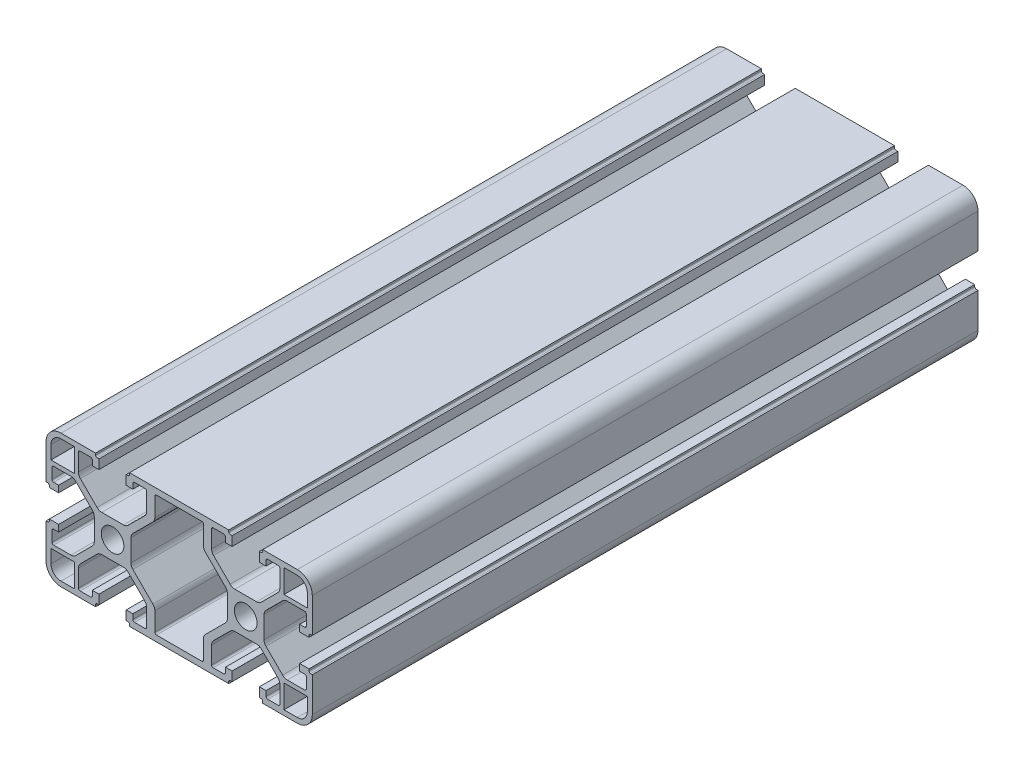
from build123d import *

# Parameters (mm, degrees)
SKETCH_1_R      = 3.4
EXTRUDE_1_DEPTH = 200


with BuildPart() as part:
    # 草图1 → 凸台-拉伸1 (new body)
    with BuildSketch(Plane.XY):
        with BuildLine():
            Line((3.257359313, 5.5), (-3.257359313, 5.5))
            ThreePointArc((-3.257359313, 5.5), (-4.022726178, 5.652240935), (-4.671572875, 6.085786438))
            Line((-4.671572875, 6.085786438), (-9.664213562, 11.078427125))
            ThreePointArc((-9.664213562, 11.078427125), (-10.097759065, 11.727273822), (-10.25, 12.492640687))
            Line((-10.25, 12.492640687), (-10.25, 17.7))
            ThreePointArc((-10.25, 17.7), (-10.103553391, 18.053553391), (-9.75, 18.2))
            Line((-9.75, 18.2), (-6.6, 18.2))
            ThreePointArc((-6.6, 18.2), (-6.246446609, 18.053553391), (-6.1, 17.7))
            Line((-6.1, 17.7), (-6.1, 16.2))
            Line((-6.1, 16.2), (-4.1, 16.2))
            Line((-4.1, 16.2), (-4.1, 19))
            Line((-4.1, 19), (-4.6, 19))
            ThreePointArc((-4.6, 19), (-4.953553391, 19.146446609), (-5.1, 19.5))
            Line((-5.1, 19.5), (-5.1, 20))
            Line((-5.1, 20), (-15.5, 20))
            ThreePointArc((-15.5, 20), (-18.681980515, 18.681980515), (-20, 15.5))
            Line((-20, 15.5), (-20, 5.1))
            Line((-20, 5.1), (-19.5, 5.1))
            ThreePointArc((-19.5, 5.1), (-19.146446609, 4.953553391), (-19, 4.6))
            Line((-19, 4.6), (-19, 4.1))
            Line((-19, 4.1), (-16.2, 4.1))
            Line((-16.2, 4.1), (-16.2, 6.1))
            Line((-16.2, 6.1), (-17.7, 6.1))
            ThreePointArc((-17.7, 6.1), (-18.053553391, 6.246446609), (-18.2, 6.6))
            Line((-18.2, 6.6), (-18.2, 9.75))
            ThreePointArc((-18.2, 9.75), (-18.053553391, 10.103553391), (-17.7, 10.25))
            Line((-17.7, 10.25), (-12.492640687, 10.25))
            ThreePointArc((-12.492640687, 10.25), (-11.727273822, 10.097759065), (-11.078427125, 9.664213562))
            Line((-11.078427125, 9.664213562), (-6.085786438, 4.671572875))
            ThreePointArc((-6.085786438, 4.671572875), (-5.652240935, 4.022726178), (-5.5, 3.257359313))
            Line((-5.5, 3.257359313), (-5.5, -3.257359313))
            ThreePointArc((-5.5, -3.257359313), (-5.652240935, -4.022726178), (-6.085786438, -4.671572875))
            Line((-6.085786438, -4.671572875), (-11.078427125, -9.664213562))
            ThreePointArc((-11.078427125, -9.664213562), (-11.727273822, -10.097759065), (-12.492640687, -10.25))
            Line((-12.492640687, -10.25), (-17.7, -10.25))
            ThreePointArc((-17.7, -10.25), (-18.053553391, -10.103553391), (-18.2, -9.75))
            Line((-18.2, -9.75), (-18.2, -6.6))
            ThreePointArc((-18.2, -6.6), (-18.053553391, -6.246446609), (-17.7, -6.1))
            Line((-17.7, -6.1), (-16.2, -6.1))
            Line((-16.2, -6.1), (-16.2, -4.1))
            Line((-16.2, -4.1), (-19, -4.1))
            Line((-19, -4.1), (-19, -4.6))
            ThreePointArc((-19, -4.6), (-19.146446609, -4.953553391), (-19.5, -5.1))
            Line((-19.5, -5.1), (-20, -5.1))
            Line((-20, -5.1), (-20, -15.5))
            ThreePointArc((-20, -15.5), (-18.681980515, -18.681980515), (-15.5, -20))
            Line((-15.5, -20), (-5.1, -20))
            Line((-5.1, -20), (-5.1, -19.5))
            ThreePointArc((-5.1, -19.5), (-4.953553391, -19.146446609), (-4.6, -19))
            Line((-4.6, -19), (-4.1, -19))
            Line((-4.1, -19), (-4.1, -16.2))
            Line((-4.1, -16.2), (-6.1, -16.2))
            Line((-6.1, -16.2), (-6.1, -17.7))
            ThreePointArc((-6.1, -17.7), (-6.246446609, -18.053553391), (-6.6, -18.2))
            Line((-6.6, -18.2), (-9.75, -18.2))
            ThreePointArc((-9.75, -18.2), (-10.103553391, -18.053553391), (-10.25, -17.7))
            Line((-10.25, -17.7), (-10.25, -12.492640687))
            ThreePointArc((-10.25, -12.492640687), (-10.097759065, -11.727273822), (-9.664213562, -11.078427125))
            Line((-9.664213562, -11.078427125), (-4.671572875, -6.085786438))
            ThreePointArc((-4.671572875, -6.085786438), (-4.022726178, -5.652240935), (-3.257359313, -5.5))
            Line((-3.257359313, -5.5), (3.257359313, -5.5))
            ThreePointArc((3.257359313, -5.5), (4.022726178, -5.652240935), (4.671572875, -6.085786438))
            Line((4.671572875, -6.085786438), (9.664213562, -11.078427125))
            ThreePointArc((9.664213562, -11.078427125), (10.097759065, -11.727273822), (10.25, -12.492640687))
            Line((10.25, -12.492640687), (10.25, -17.7))
            ThreePointArc((10.25, -17.7), (10.103553391, -18.053553391), (9.75, -18.2))
            Line((9.75, -18.2), (6.6, -18.2))
            ThreePointArc((6.6, -18.2), (6.246446609, -18.053553391), (6.1, -17.7))
            Line((6.1, -17.7), (6.1, -16.2))
            Line((6.1, -16.2), (4.1, -16.2))
            Line((4.1, -16.2), (4.1, -19))
            Line((4.1, -19), (4.6, -19))
            ThreePointArc((4.6, -19), (4.953553391, -19.146446609), (5.1, -19.5))
            Line((5.1, -19.5), (5.1, -20))
            Line((5.1, -20), (34.9, -20))
            Line((34.9, -20), (34.9, -19.5))
            ThreePointArc((34.9, -19.5), (35.046446609, -19.146446609), (35.4, -19))
            Line((35.4, -19), (35.9, -19))
            Line((35.9, -19), (35.9, -16.2))
            Line((35.9, -16.2), (33.9, -16.2))
            Line((33.9, -16.2), (33.9, -17.7))
            ThreePointArc((33.9, -17.7), (33.753553391, -18.053553391), (33.4, -18.2))
            Line((33.4, -18.2), (30.25, -18.2))
            ThreePointArc((30.25, -18.2), (29.896446609, -18.053553391), (29.75, -17.7))
            Line((29.75, -17.7), (29.75, -12.492640687))
            ThreePointArc((29.75, -12.492640687), (29.902240935, -11.727273822), (30.335786438, -11.078427125))
            Line((30.335786438, -11.078427125), (35.328427125, -6.085786438))
            ThreePointArc((35.328427125, -6.085786438), (35.977273822, -5.652240935), (36.742640687, -5.5))
            Line((36.742640687, -5.5), (43.257359313, -5.5))
            ThreePointArc((43.257359313, -5.5), (44.022726178, -5.652240935), (44.671572875, -6.085786438))
            Line((44.671572875, -6.085786438), (49.664213562, -11.078427125))
            ThreePointArc((49.664213562, -11.078427125), (50.097759065, -11.727273822), (50.25, -12.492640687))
            Line((50.25, -12.492640687), (50.25, -17.7))
            ThreePointArc((50.25, -17.7), (50.103553391, -18.053553391), (49.75, -18.2))
            Line((49.75, -18.2), (46.6, -18.2))
            ThreePointArc((46.6, -18.2), (46.246446609, -18.053553391), (46.1, -17.7))
            Line((46.1, -17.7), (46.1, -16.2))
            Line((46.1, -16.2), (44.1, -16.2))
            Line((44.1, -16.2), (44.1, -19))
            Line((44.1, -19), (44.6, -19))
            ThreePointArc((44.6, -19), (44.953553391, -19.146446609), (45.1, -19.5))
            Line((45.1, -19.5), (45.1, -20))
            Line((45.1, -20), (55.5, -20))
            ThreePointArc((55.5, -20), (58.681980515, -18.681980515), (60, -15.5))
            Line((60, -15.5), (60, -5.1))
            Line((60, -5.1), (59.5, -5.1))
            ThreePointArc((59.5, -5.1), (59.146446609, -4.953553391), (59, -4.6))
            Line((59, -4.6), (59, -4.1))
            Line((59, -4.1), (56.2, -4.1))
            Line((56.2, -4.1), (56.2, -6.1))
            Line((56.2, -6.1), (57.7, -6.1))
            ThreePointArc((57.7, -6.1), (58.053553391, -6.246446609), (58.2, -6.6))
            Line((58.2, -6.6), (58.2, -9.75))
            ThreePointArc((58.2, -9.75), (58.053553391, -10.103553391), (57.7, -10.25))
            Line((57.7, -10.25), (52.492640687, -10.25))
            ThreePointArc((52.492640687, -10.25), (51.727273822, -10.097759065), (51.078427125, -9.664213562))
            Line((51.078427125, -9.664213562), (46.085786438, -4.671572875))
            ThreePointArc((46.085786438, -4.671572875), (45.652240935, -4.022726178), (45.5, -3.257359313))
            Line((45.5, -3.257359313), (45.5, 3.257359313))
            ThreePointArc((45.5, 3.257359313), (45.652240935, 4.022726178), (46.085786438, 4.671572875))
            Line((46.085786438, 4.671572875), (51.078427125, 9.664213562))
            ThreePointArc((51.078427125, 9.664213562), (51.727273822, 10.097759065), (52.492640687, 10.25))
            Line((52.492640687, 10.25), (57.7, 10.25))
            ThreePointArc((57.7, 10.25), (58.053553391, 10.103553391), (58.2, 9.75))
            Line((58.2, 9.75), (58.2, 6.6))
            ThreePointArc((58.2, 6.6), (58.053553391, 6.246446609), (57.7, 6.1))
            Line((57.7, 6.1), (56.2, 6.1))
            Line((56.2, 6.1), (56.2, 4.1))
            Line((56.2, 4.1), (59, 4.1))
            Line((59, 4.1), (59, 4.6))
            ThreePointArc((59, 4.6), (59.146446609, 4.953553391), (59.5, 5.1))
            Line((59.5, 5.1), (60, 5.1))
            Line((60, 5.1), (60, 15.5))
            ThreePointArc((60, 15.5), (58.681980515, 18.681980515), (55.5, 20))
            Line((55.5, 20), (45.1, 20))
            Line((45.1, 20), (45.1, 19.5))
            ThreePointArc((45.1, 19.5), (44.953553391, 19.146446609), (44.6, 19))
            Line((44.6, 19), (44.1, 19))
            Line((44.1, 19), (44.1, 16.2))
            Line((44.1, 16.2), (46.1, 16.2))
            Line((46.1, 16.2), (46.1, 17.7))
            ThreePointArc((46.1, 17.7), (46.246446609, 18.053553391), (46.6, 18.2))
            Line((46.6, 18.2), (49.75, 18.2))
            ThreePointArc((49.75, 18.2), (50.103553391, 18.053553391), (50.25, 17.7))
            Line((50.25, 17.7), (50.25, 12.492640687))
            ThreePointArc((50.25, 12.492640687), (50.097759065, 11.727273822), (49.664213562, 11.078427125))
            Line((49.664213562, 11.078427125), (44.671572875, 6.085786438))
            ThreePointArc((44.671572875, 6.085786438), (44.022726178, 5.652240935), (43.257359313, 5.5))
            Line((43.257359313, 5.5), (36.742640687, 5.5))
            ThreePointArc((36.742640687, 5.5), (35.977273822, 5.652240935), (35.328427125, 6.085786438))
            Line((35.328427125, 6.085786438), (30.335786438, 11.078427125))
            ThreePointArc((30.335786438, 11.078427125), (29.902240935, 11.727273822), (29.75, 12.492640687))
            Line((29.75, 12.492640687), (29.75, 17.7))
            ThreePointArc((29.75, 17.7), (29.896446609, 18.053553391), (30.25, 18.2))
            Line((30.25, 18.2), (33.4, 18.2))
            ThreePointArc((33.4, 18.2), (33.753553391, 18.053553391), (33.9, 17.7))
            Line((33.9, 17.7), (33.9, 16.2))
            Line((33.9, 16.2), (35.9, 16.2))
            Line((35.9, 16.2), (35.9, 19))
            Line((35.9, 19), (35.4, 19))
            ThreePointArc((35.4, 19), (35.046446609, 19.146446609), (34.9, 19.5))
            Line((34.9, 19.5), (34.9, 20))
            Line((34.9, 20), (5.1, 20))
            Line((5.1, 20), (5.1, 19.5))
            ThreePointArc((5.1, 19.5), (4.953553391, 19.146446609), (4.6, 19))
            Line((4.6, 19), (4.1, 19))
            Line((4.1, 19), (4.1, 16.2))
            Line((4.1, 16.2), (6.1, 16.2))
            Line((6.1, 16.2), (6.1, 17.7))
            ThreePointArc((6.1, 17.7), (6.246446609, 18.053553391), (6.6, 18.2))
            Line((6.6, 18.2), (9.75, 18.2))
            ThreePointArc((9.75, 18.2), (10.103553391, 18.053553391), (10.25, 17.7))
            Line((10.25, 17.7), (10.25, 12.492640687))
            ThreePointArc((10.25, 12.492640687), (10.097759065, 11.727273822), (9.664213562, 11.078427125))
            Line((9.664213562, 11.078427125), (4.671572875, 6.085786438))
            ThreePointArc((4.671572875, 6.085786438), (4.022726178, 5.652240935), (3.257359313, 5.5))
        make_face()
        with BuildLine():
            Line((-11.5, -11.5), (-11.5, -18.5))
            Line((-11.5, -18.5), (-15.5, -18.5))
            ThreePointArc((-15.5, -18.5), (-17.621320344, -17.621320344), (-18.5, -15.5))
            Line((-18.5, -15.5), (-18.5, -11.5))
            Line((-18.5, -11.5), (-11.5, -11.5))
        make_face(mode=Mode.SUBTRACT)
        with BuildLine():
            Line((58.5, -11.5), (58.5, -15.5))
            ThreePointArc((58.5, -15.5), (57.621320344, -17.621320344), (55.5, -18.5))
            Line((55.5, -18.5), (51.5, -18.5))
            Line((51.5, -18.5), (51.5, -11.5))
            Line((51.5, -11.5), (58.5, -11.5))
        make_face(mode=Mode.SUBTRACT)
        with Locations((40, 0)):
            Circle(SKETCH_1_R, mode=Mode.SUBTRACT)
        Circle(SKETCH_1_R, mode=Mode.SUBTRACT)
        with BuildLine():
            Line((-18.5, 11.5), (-18.5, 15.5))
            ThreePointArc((-18.5, 15.5), (-17.621320344, 17.621320344), (-15.5, 18.5))
            Line((-15.5, 18.5), (-11.5, 18.5))
            Line((-11.5, 18.5), (-11.5, 11.5))
            Line((-11.5, 11.5), (-18.5, 11.5))
        make_face(mode=Mode.SUBTRACT)
        with BuildLine():
            Line((5.5, -3.257359313), (5.5, 3.257359313))
            ThreePointArc((5.5, 3.257359313), (5.652240935, 4.022726178), (6.085786438, 4.671572875))
            Line((6.085786438, 4.671572875), (12.114213562, 10.7))
            ThreePointArc((12.114213562, 10.7), (12.547759065, 11.348846698), (12.7, 12.114213562))
            Line((12.7, 12.114213562), (12.7, 17.7))
            ThreePointArc((12.7, 17.7), (12.846446609, 18.053553391), (13.2, 18.2))
            Line((13.2, 18.2), (26.8, 18.2))
            ThreePointArc((26.8, 18.2), (27.153553391, 18.053553391), (27.3, 17.7))
            Line((27.3, 17.7), (27.3, 12.114213562))
            ThreePointArc((27.3, 12.114213562), (27.452240935, 11.348846698), (27.885786438, 10.7))
            Line((27.885786438, 10.7), (33.914213562, 4.671572875))
            ThreePointArc((33.914213562, 4.671572875), (34.347759065, 4.022726178), (34.5, 3.257359313))
            Line((34.5, 3.257359313), (34.5, -3.257359313))
            ThreePointArc((34.5, -3.257359313), (34.347759065, -4.022726178), (33.914213562, -4.671572875))
            Line((33.914213562, -4.671572875), (27.885786438, -10.7))
            ThreePointArc((27.885786438, -10.7), (27.452240935, -11.348846698), (27.3, -12.114213562))
            Line((27.3, -12.114213562), (27.3, -17.7))
            ThreePointArc((27.3, -17.7), (27.153553391, -18.053553391), (26.8, -18.2))
            Line((26.8, -18.2), (13.2, -18.2))
            ThreePointArc((13.2, -18.2), (12.846446609, -18.053553391), (12.7, -17.7))
            Line((12.7, -17.7), (12.7, -12.114213562))
            ThreePointArc((12.7, -12.114213562), (12.547759065, -11.348846698), (12.114213562, -10.7))
            Line((12.114213562, -10.7), (6.085786438, -4.671572875))
            ThreePointArc((6.085786438, -4.671572875), (5.652240935, -4.022726178), (5.5, -3.257359313))
        make_face(mode=Mode.SUBTRACT)
        with BuildLine():
            ThreePointArc((55.5, 18.5), (57.621320344, 17.621320344), (58.5, 15.5))
            Line((58.5, 15.5), (58.5, 11.5))
            Line((58.5, 11.5), (51.5, 11.5))
            Line((51.5, 11.5), (51.5, 18.5))
            Line((51.5, 18.5), (55.5, 18.5))
        make_face(mode=Mode.SUBTRACT)
    extrude(amount=EXTRUDE_1_DEPTH)


solid = part.part
